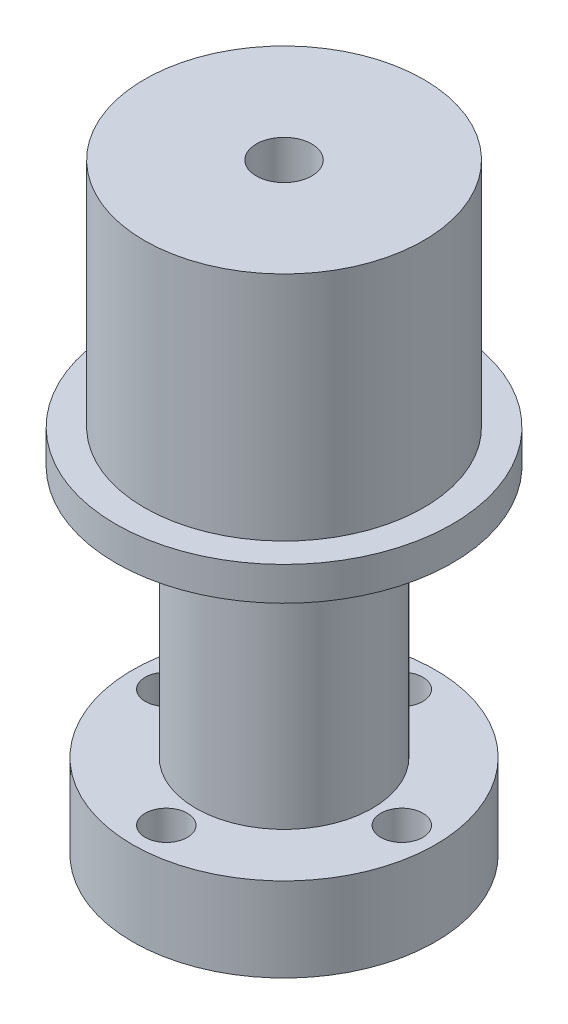
from build123d import *

# Parameters (mm, degrees)
SKETCH_1_R             = 9
EXTRUDE_1_DEPTH        = 5
SKETCH_3_R             = 5.25
EXTRUDE_2_DEPTH        = 15
SKETCH_4_R             = 10
EXTRUDE_4_DEPTH        = 2
SKETCH_5_R             = 8.3
EXTRUDE_5_DEPTH        = 13.75
HOLE_WIZARD_M3_1_D     = 2.5
HOLE_WIZARD_M3_1_DEPTH = 5
SKETCH_8_R             = 5
EXTRUDE_6_DEPTH        = 2
HOLE_WIZARD_M4_3_D     = 3.3
HOLE_WIZARD_M4_3_DEPTH = 10.1
HOLE_WIZARD_M4_3_TIP   = 0.991420021


with BuildPart() as part:
    # 草图1 → 凸台-拉伸1 (new body)
    with BuildSketch(Plane(origin=(0, 0, 0), x_dir=(1, 0, 0), z_dir=(0, 1, 0))):
        with Locations(Location((0, 0, 0), (0, 0, 270))):
            Circle(SKETCH_1_R)
    extrude(amount=EXTRUDE_1_DEPTH)

    # 草图3 → 凸台-拉伸2 (add)
    with BuildSketch(Plane(origin=(0, 5, 0), x_dir=(1, 0, 0), z_dir=(0, 1, 0))):
        with Locations(Location((0, 0, 0), (0, 0, 270))):
            Circle(SKETCH_3_R)
    extrude(amount=EXTRUDE_2_DEPTH)

    # 草图4 → 凸台-拉伸4 (add)
    with BuildSketch(Plane(origin=(0, 20, 0), x_dir=(1, 0, 0), z_dir=(0, 1, 0))):
        with Locations(Location((0, 0, 0), (0, 0, 270))):
            Circle(SKETCH_4_R)
    extrude(amount=EXTRUDE_4_DEPTH)

    # 草图5 → 凸台-拉伸5 (add)
    with BuildSketch(Plane(origin=(0, 22, 0), x_dir=(1, 0, 0), z_dir=(0, 1, 0))):
        with Locations(Location((0, 0, 0), (0, 0, 270))):
            Circle(SKETCH_5_R)
    extrude(amount=EXTRUDE_5_DEPTH)

    # M3 螺纹孔1
    with Locations(Plane(origin=(0, 0, 0), x_dir=(-1, 0, 0), z_dir=(0, -1, 0))):
        with Locations((0, 7), (-7, 0), (7, 0), (0, -7)):
            Hole(HOLE_WIZARD_M3_1_D / 2, depth=HOLE_WIZARD_M3_1_DEPTH)

    # 草图8 → 凸台-拉伸6 (add)
    with BuildSketch(Plane.XZ):
        with Locations(Location((0, 0, 0), (0, 0, 270))):
            Circle(SKETCH_8_R)
    extrude(amount=EXTRUDE_6_DEPTH)

    # M4 螺纹孔3
    with Locations(Plane(origin=(0, 35.75, 0), x_dir=(1, 0, 0), z_dir=(0, 1, 0))):
        with Locations((0, 0)):
            Hole(HOLE_WIZARD_M4_3_D / 2, depth=HOLE_WIZARD_M4_3_DEPTH)
            with Locations((0, 0, -(HOLE_WIZARD_M4_3_DEPTH + HOLE_WIZARD_M4_3_TIP / 2))):  # 118° drill point
                Cone(0, HOLE_WIZARD_M4_3_D / 2, HOLE_WIZARD_M4_3_TIP, mode=Mode.SUBTRACT)


solid = part.part
